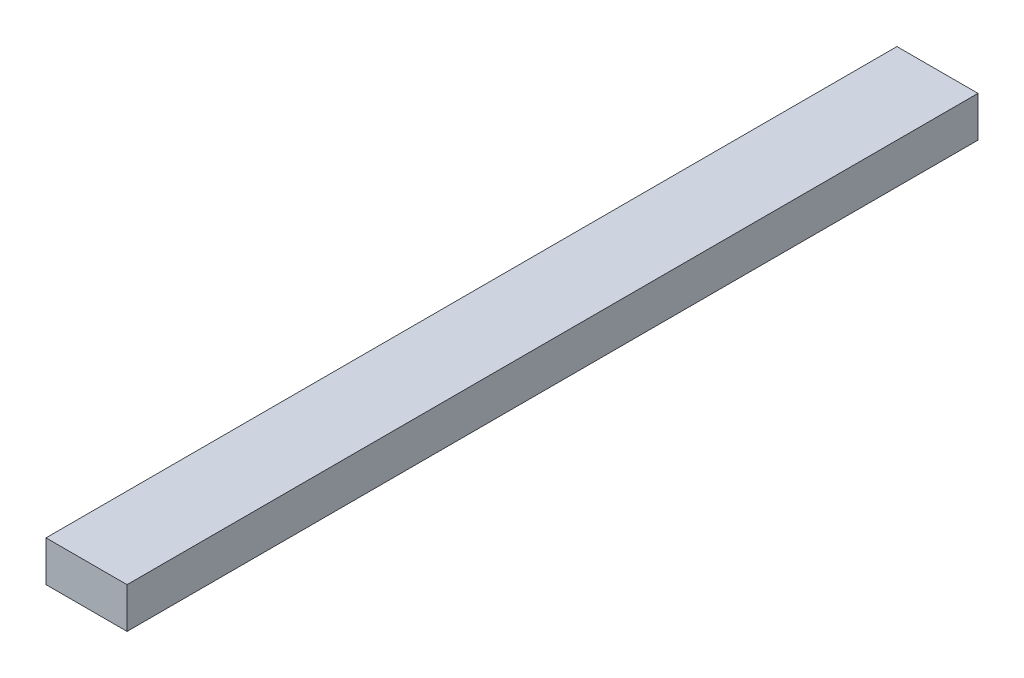
from build123d import *

# Parameters (mm, degrees)
SKETCH1_W           = 38.1
SKETCH1_H           = 19.05
BOSS_EXTRUDE1_DEPTH = 400


with BuildPart() as part:
    # Sketch1 → Boss-Extrude1 (new body)
    with BuildSketch(Plane.XY):
        Rectangle(SKETCH1_W, SKETCH1_H)
    extrude(amount=BOSS_EXTRUDE1_DEPTH)


solid = part.part
